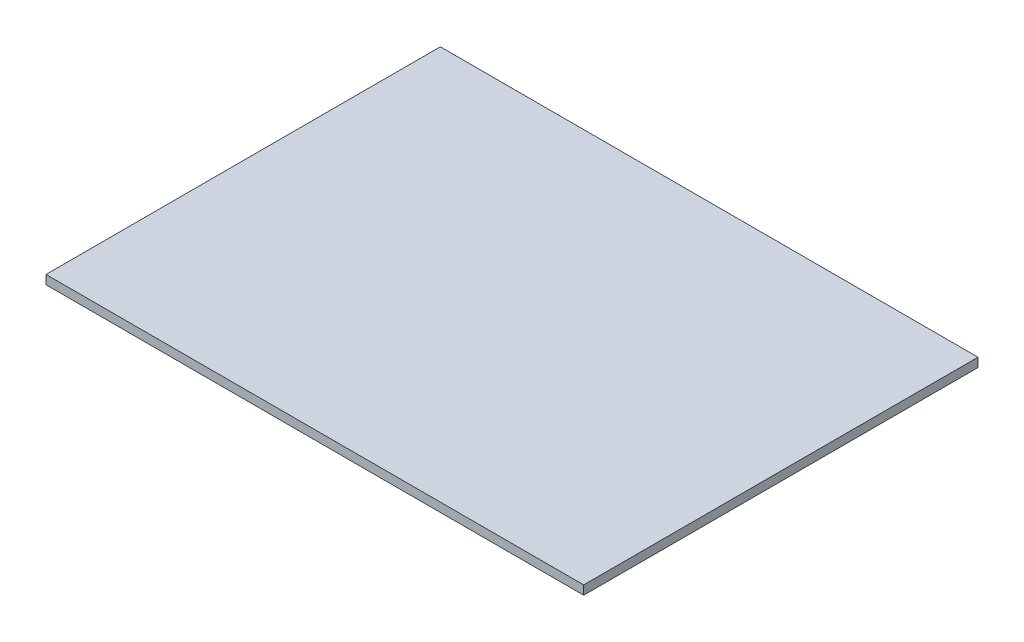
from build123d import *

# Parameters (mm, degrees)
SKETCH1_W           = 300
SKETCH1_H           = 220
BOSS_EXTRUDE1_DEPTH = 5


with BuildPart() as part:
    # Sketch1 → Boss-Extrude1 (new body)
    with BuildSketch(Plane(origin=(0, 0, 0), x_dir=(1, 0, 0), z_dir=(0, 1, 0))):
        Rectangle(SKETCH1_W, SKETCH1_H)
    extrude(amount=BOSS_EXTRUDE1_DEPTH)


solid = part.part
